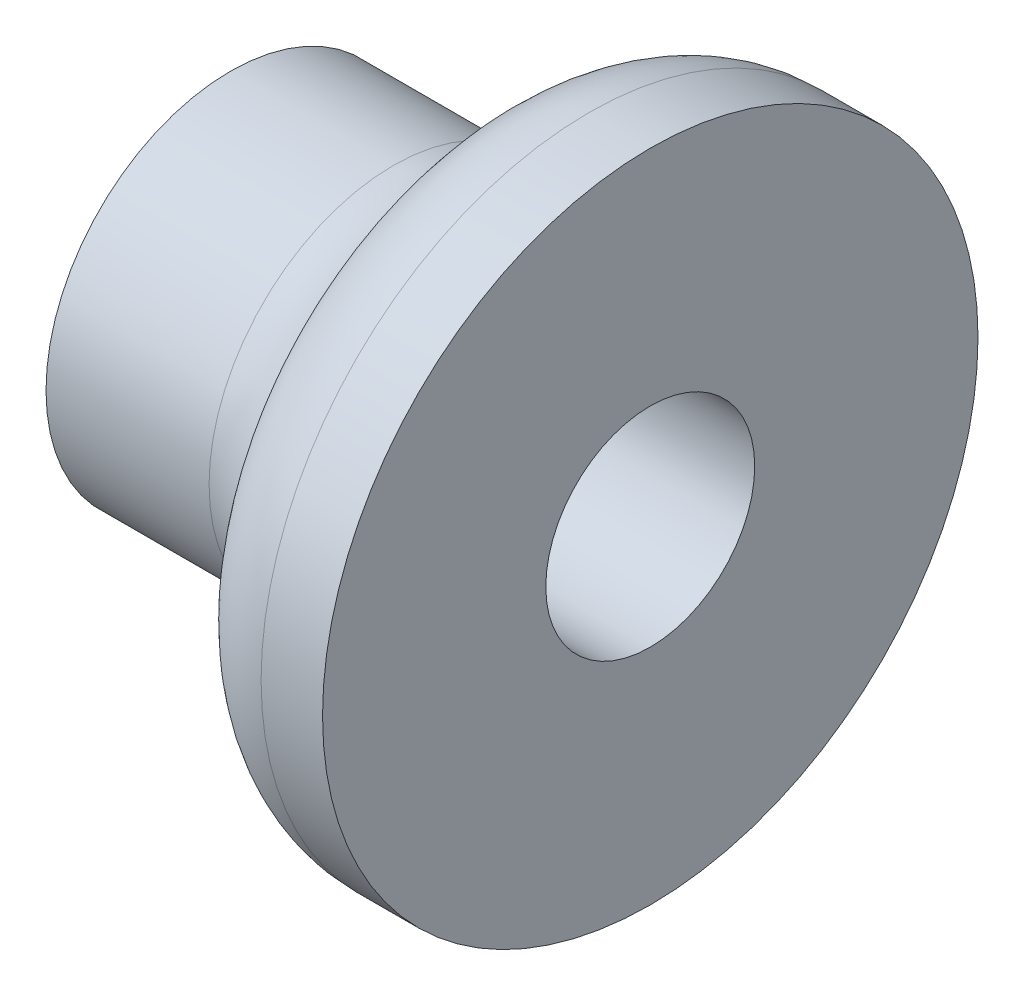
from build123d import *

# Parameters (mm, degrees)
SKETCH1_R           = 4.5
BOSS_EXTRUDE1_DEPTH = 10.25
SKETCH3_R           = 2.55
CUT_EXTRUDE1_DEPTH  = 34
BOSS_EXTRUDE2_START = -4
SKETCH4_R           = 8
SKETCH4_R_2         = 4.5
BOSS_EXTRUDE2_DEPTH = 4
FILLET1_R           = 2.5
FILLET2_R           = 2.5
SKETCH5_R           = 3
SKETCH5_R_2         = 2.55
CUT_EXTRUDE2_DEPTH  = 0.7


with BuildPart() as part:
    # Sketch1 → Boss-Extrude1 (new body)
    with BuildSketch(Plane(origin=(0, 0, 0), x_dir=(0, 0, -1), z_dir=(1, 0, 0))):
        Circle(SKETCH1_R)
    extrude(amount=BOSS_EXTRUDE1_DEPTH)

    # Sketch3 → Cut-Extrude1 (cut)
    with BuildSketch(Plane.ZY):
        Circle(SKETCH3_R)
    extrude(amount=-CUT_EXTRUDE1_DEPTH, mode=Mode.SUBTRACT)

    # Sketch4 → Boss-Extrude2 (add)
    with BuildSketch(Plane(origin=(10.25, 0, 0), x_dir=(0, 0, -1), z_dir=(1, 0, 0)).offset(BOSS_EXTRUDE2_START)):
        Circle(SKETCH4_R)
        Circle(SKETCH4_R_2, mode=Mode.SUBTRACT)
    extrude(amount=BOSS_EXTRUDE2_DEPTH)

    # Fillet1
    fillet1_edges = [part.edges().sort_by_distance(p)[0] for p in [
        (6.25, 0, 8),
    ]]
    fillet(fillet1_edges, radius=FILLET1_R)

    # Fillet2
    fillet2_edges = [part.edges().sort_by_distance(p)[0] for p in [
        (6.25, 0, 4.5),
    ]]
    fillet(fillet2_edges, radius=FILLET2_R)

    # Sketch5 → Cut-Extrude2 (cut)
    with BuildSketch(Plane.ZY):
        Circle(SKETCH5_R)
        Circle(SKETCH5_R_2, mode=Mode.SUBTRACT)
    extrude(amount=-CUT_EXTRUDE2_DEPTH, mode=Mode.SUBTRACT)


solid = part.part
